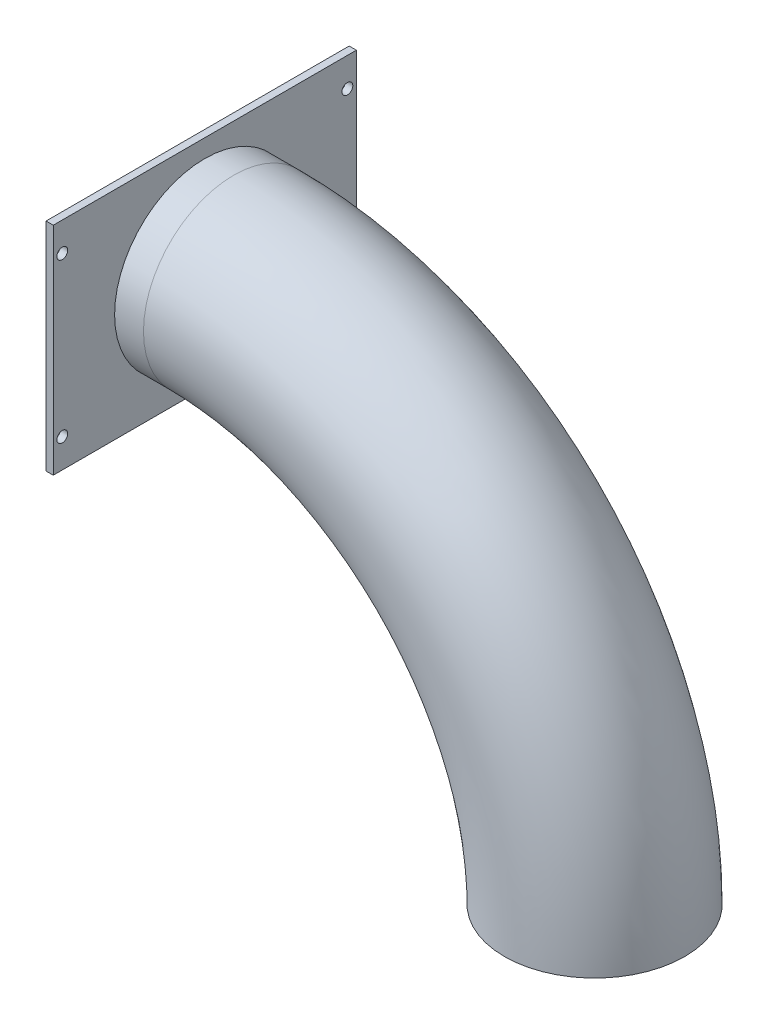
from build123d import *
from build123d.topology import SkipClean

# Parameters (mm, degrees)
IZIM2_R                     = 25
IZIM4_R                     = 24
IZIM5_W                     = 84
IZIM5_H                     = 60
IZIM5_R                     = 24
IZIM5_R_2                   = 1.5
Y_KSEKLIK_EKSTR_ZYON1_DEPTH = 2


with BuildPart() as part:
    # Süpür1: sweep along a path in Çizim1
    with BuildLine(Plane.XY) as s_p_r1_path:
        Line((-108, 100), (-100, 100))
        ThreePointArc((-100, 100), (-29.289321881, 70.710678119), (0, 0))
    # Çizim2 → Süpür1 (sweep)
    with BuildSketch(Plane(origin=(0, 0, 0), x_dir=(1, 0, 0), z_dir=(0, 1, 0))):
        Circle(IZIM2_R)
    sweep(path=s_p_r1_path.line)

    # Kes-Süpür1: sweep along a path in Çizim3
    with BuildLine(Plane.XY) as kes_s_p_r1_path:
        Line((-108, 100), (-100, 100))
        ThreePointArc((-100, 100), (-29.289321881, 70.710678119), (0, 0))
    # Çizim4 → Kes-Süpür1 (sweep, cut)
    with BuildSketch(Plane(origin=(0, 0, 0), x_dir=(1, 0, 0), z_dir=(0, 1, 0))):
        Circle(IZIM4_R)
    sweep(path=kes_s_p_r1_path.line, mode=Mode.SUBTRACT)

    # Çizim5 → Yükseklik-Ekstrüzyon1 (add)
    with SkipClean():  # the faces are left unmerged after this step: merging them gives an invalid solid
        with BuildSketch(Plane.ZY.offset(108)):
            with Locations((0, 100)):
                Rectangle(IZIM5_W, IZIM5_H)
            with Locations((0, 100)):
                Circle(IZIM5_R, mode=Mode.SUBTRACT)
            with Locations((-39.5, 122)):
                Circle(IZIM5_R_2, mode=Mode.SUBTRACT)
            with Locations((39.5, 122)):
                Circle(IZIM5_R_2, mode=Mode.SUBTRACT)
            with Locations((39.5, 78)):
                Circle(IZIM5_R_2, mode=Mode.SUBTRACT)
            with Locations((-39.5, 78)):
                Circle(IZIM5_R_2, mode=Mode.SUBTRACT)
        extrude(amount=Y_KSEKLIK_EKSTR_ZYON1_DEPTH)


solid = part.part
